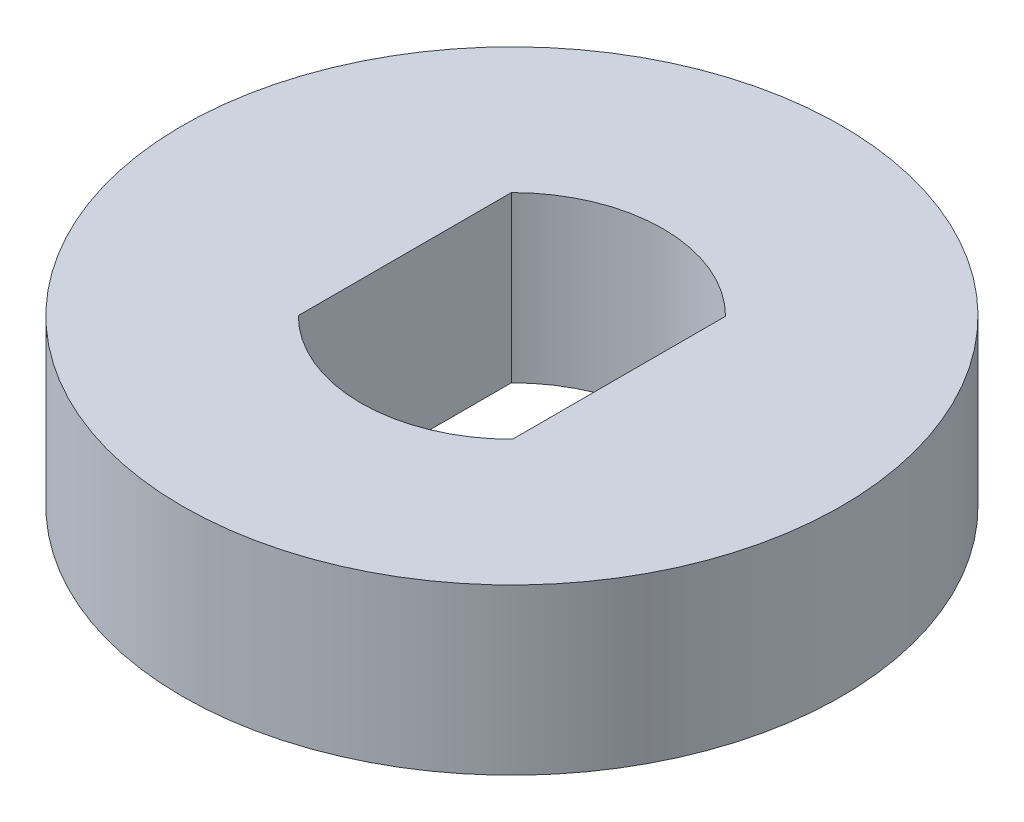
from build123d import *

# Parameters (mm, degrees)
BOSS_EXTRUDE1_DEPTH = 3


with BuildPart() as part:
    # Sketch1 → Boss-Extrude1 (new body)
    with BuildSketch(Plane(origin=(0, 0, 0), x_dir=(1, 0, 0), z_dir=(0, 1, 0))):
        with BuildLine():
            ThreePointArc((2.75, 0), (2.542144764, 1.048808848), (1.95, 1.939071943))
            Line((1.95, 1.939071943), (1.95, -1.939071943))
            ThreePointArc((1.95, -1.939071943), (2.542144764, -1.048808848), (2.75, 0))
        make_face()
        with BuildLine():
            ThreePointArc((1.95, 5.674284096), (0, 6), (-1.95, 5.674284096))
            Line((-1.95, 5.674284096), (-1.95, 1.939071943))
            ThreePointArc((-1.95, 1.939071943), (0, 2.75), (1.95, 1.939071943))
            Line((1.95, 1.939071943), (1.95, 5.674284096))
        make_face()
        with BuildLine():
            Line((-1.95, -1.939071943), (-1.95, -5.674284096))
            ThreePointArc((-1.95, -5.674284096), (0, -6), (1.95, -5.674284096))
            Line((1.95, -5.674284096), (1.95, -1.939071943))
            ThreePointArc((1.95, -1.939071943), (0, -2.75), (-1.95, -1.939071943))
        make_face()
        with BuildLine():
            Line((-1.95, 1.939071943), (-1.95, 5.674284096))
            ThreePointArc((-1.95, 5.674284096), (-6, 0), (-1.95, -5.674284096))
            Line((-1.95, -5.674284096), (-1.95, -1.939071943))
            ThreePointArc((-1.95, -1.939071943), (-2.75, 0), (-1.95, 1.939071943))
        make_face()
        with BuildLine():
            ThreePointArc((6, 0), (4.883646179, 3.485685012), (1.95, 5.674284096))
            Line((1.95, 5.674284096), (1.95, 1.939071943))
            ThreePointArc((1.95, 1.939071943), (2.542144764, 1.048808848), (2.75, 0))
            ThreePointArc((2.75, 0), (2.542144764, -1.048808848), (1.95, -1.939071943))
            Line((1.95, -1.939071943), (1.95, -5.674284096))
            ThreePointArc((1.95, -5.674284096), (4.883646179, -3.485685012), (6, 0))
        make_face()
        with BuildLine():
            Line((-1.95, -1.939071943), (-1.95, 1.939071943))
            ThreePointArc((-1.95, 1.939071943), (-2.75, 0), (-1.95, -1.939071943))
        make_face()
    extrude(amount=BOSS_EXTRUDE1_DEPTH)


solid = part.part
